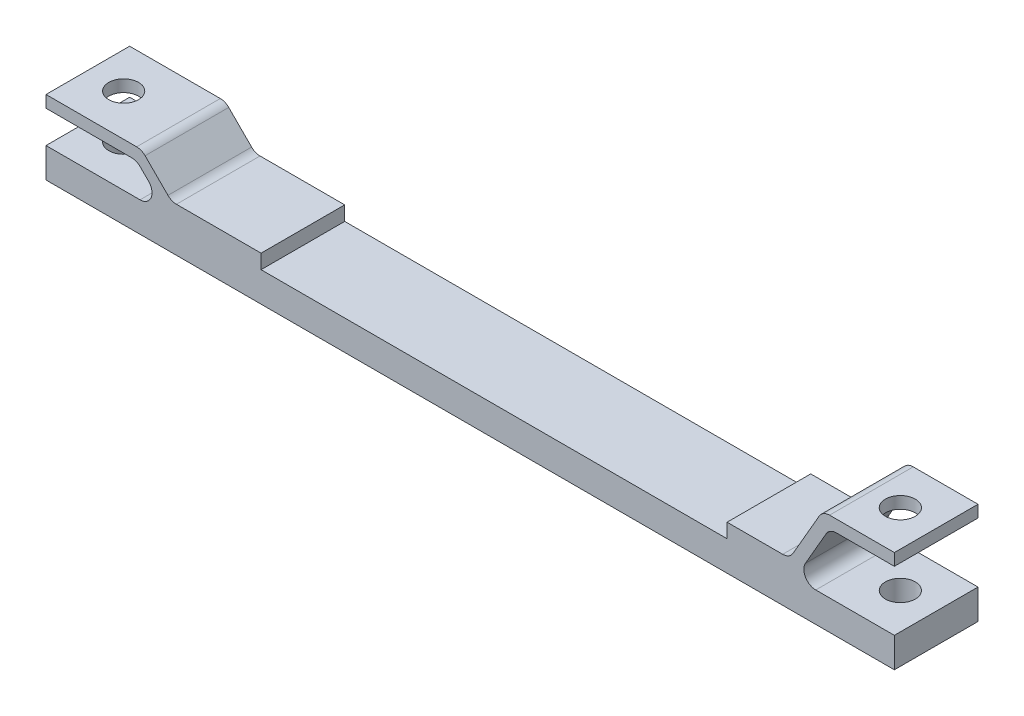
from build123d import *

# Parameters (mm, degrees)
BOSS_EXTRUDE3_DEPTH     = 105
FILLET4_R               = 15
FILLET5_R               = 15
FILLET6_R               = 15
FILLET7_R               = 15
FILLET8_R               = 15
CUT_EXTRUDE3_DEPTH      = 1075.196909441
CUT_EXTRUDE3_DEPTH_BACK = 1075.196909441
SKETCH2_R               = 18.75


with BuildPart() as part:
    # Sketch1 → Boss-Extrude3 (new body)
    with BuildSketch(Plane.XY):
        Polygon((0, 93), (0, 78), (113.786796564, 78), (154.286796564, 37.5), (0, 37.5), (0, 0), (1065, 0), (1065, 37.5), (940.922649001, 37.5), (946.421161675, 48), (983.660254038, 112.5), (1065, 112.5), (1065, 127.5), (975, 127.5), (933.430780618, 55.5), (855, 55.5), (855, 37.5), (270, 37.5), (270, 55.5), (157.5, 55.5), (120, 93), align=None)
    extrude(amount=-BOSS_EXTRUDE3_DEPTH)

    # Fillet4
    fillet4_edges = [part.edges().sort_by_distance(p)[0] for p in [
        (157.5, 55.5, -52.5),
        (120, 93, -52.5),
        (940.922649001, 37.5, -52.5),
        (975, 127.5, -52.5),
    ]]
    fillet(fillet4_edges, radius=FILLET4_R)

    # Fillet5
    fillet5_edges = [part.edges().sort_by_distance(p)[0] for p in [
        (113.786796564, 78, -52.5),
    ]]
    fillet(fillet5_edges, radius=FILLET5_R)

    # Fillet6
    fillet6_edges = [part.edges().sort_by_distance(p)[0] for p in [
        (154.286796564, 37.5, -52.5),
    ]]
    fillet(fillet6_edges, radius=FILLET6_R)

    # Fillet7
    fillet7_edges = [part.edges().sort_by_distance(p)[0] for p in [
        (933.430780618, 55.5, -52.5),
    ]]
    fillet(fillet7_edges, radius=FILLET7_R)

    # Fillet8
    fillet8_edges = [part.edges().sort_by_distance(p)[0] for p in [
        (983.660254038, 112.5, -52.5),
    ]]
    fillet(fillet8_edges, radius=FILLET8_R)

    # Sketch2 → Cut-Extrude3 (cut, two sides: drawn at the far end of the back side and taken through both)
    with BuildSketch(Plane(origin=(0, 93, 0), x_dir=(1, 0, 0), z_dir=(0, 1, 0)).offset(-CUT_EXTRUDE3_DEPTH_BACK)):
        with Locations(Location((45, 52.5, 0), (0, 0, 270))):
            Circle(SKETCH2_R)
        with Locations(Location((1020, 52.5, 0), (0, 0, 270))):
            Circle(SKETCH2_R)
    extrude(amount=CUT_EXTRUDE3_DEPTH + CUT_EXTRUDE3_DEPTH_BACK, mode=Mode.SUBTRACT)


solid = part.part
